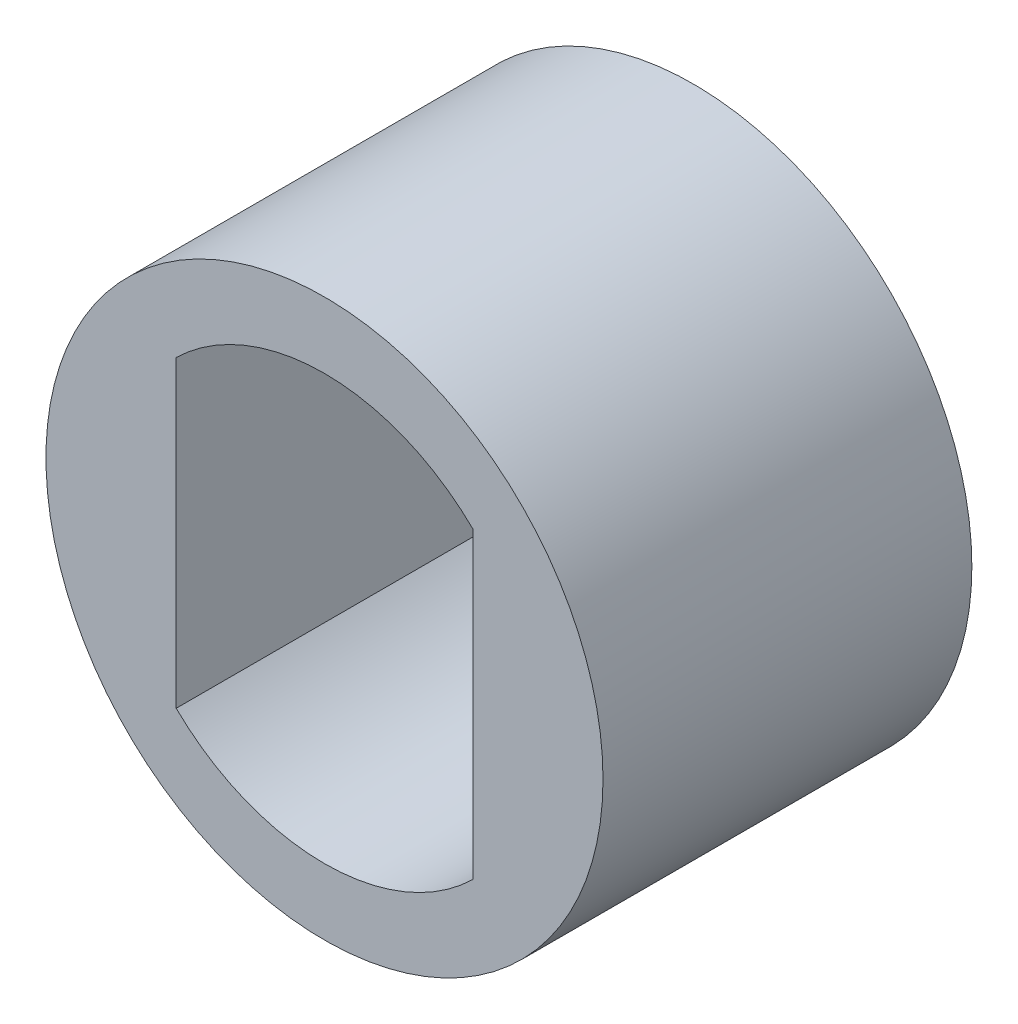
from build123d import *

# Parameters (mm, degrees)
ESBO_O2_R                = 3.7
RESSALTO_EXTRUS_O1_DEPTH = 4.9


with BuildPart() as part:
    # Esboço2 → Ressalto-extrusão1 (new body)
    with BuildSketch(Plane.XY):
        Circle(ESBO_O2_R)
        with BuildLine():
            Line((1.97, -2.017795827), (1.97, 2.017795827))
            ThreePointArc((1.97, 2.017795827), (0, 2.82), (-1.97, 2.017795827))
            Line((-1.97, 2.017795827), (-1.97, -2.017795827))
            ThreePointArc((-1.97, -2.017795827), (0, -2.82), (1.97, -2.017795827))
        make_face(mode=Mode.SUBTRACT)
    extrude(amount=RESSALTO_EXTRUS_O1_DEPTH)


solid = part.part
